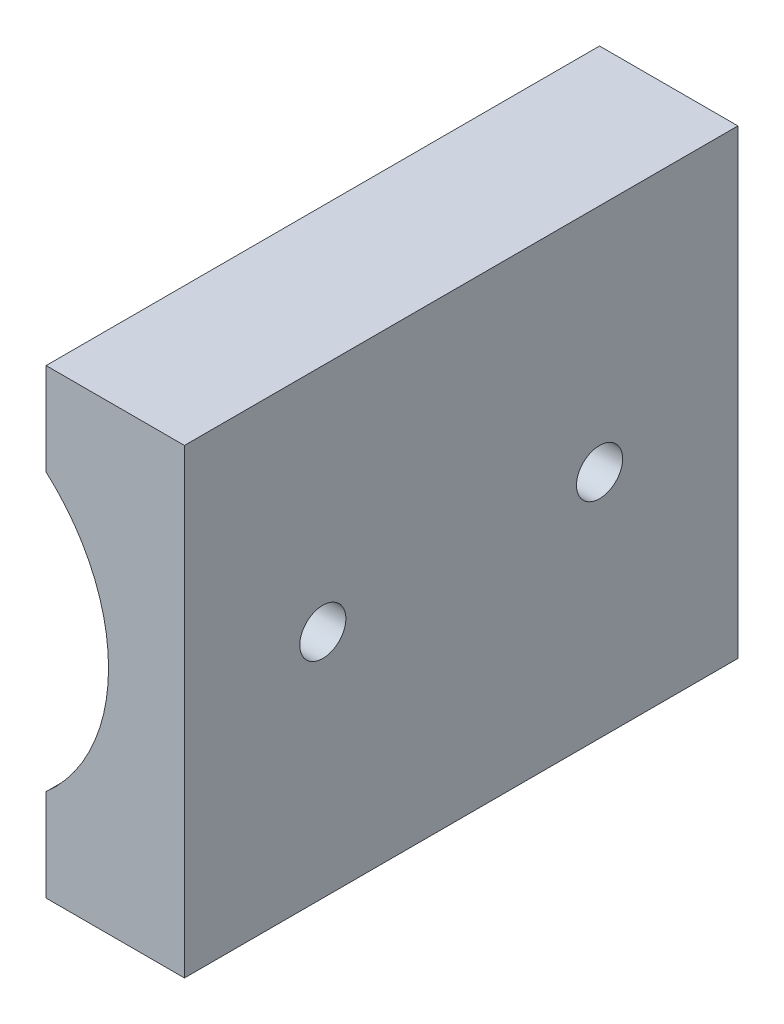
from build123d import *

# Parameters (mm, degrees)
BOSS_EXTRUDE1_DEPTH            = 60
CUT_EXTRUDE1_REACH             = 69.704
CUT_EXTRUDE1_END_RADIUS        = 20
SKETCH3_R                      = 2.5
CUT_EXTRUDE1_DIRECTION_2_DEPTH = 68.704354886


with BuildPart() as part:
    # Sketch2 → Boss-Extrude1 (new body)
    with BuildSketch(Plane.XY):
        with BuildLine():
            Line((0, 22.452229299), (0, -27.547770701))
            Line((0, -27.547770701), (-15, -27.547770701))
            Line((-15, -27.547770701), (-15, -17.547770701))
            ThreePointArc((-15, -17.547770701), (-8.228756555, -2.547770701), (-15, 12.452229299))
            Line((-15, 12.452229299), (-15, 22.452229299))
            Line((-15, 22.452229299), (0, 22.452229299))
        make_face()
    extrude(amount=BOSS_EXTRUDE1_DEPTH)

    # Cut-Extrude1: up to this cylinder (the profile starts outside it)
    cut_extrude1_end = Plane(origin=(-28.228756555, -2.547770701, 30), z_dir=(0, 0, -1)) * Cylinder(CUT_EXTRUDE1_END_RADIUS, 210.408, mode=Mode.PRIVATE)
    # Sketch3 → Cut-Extrude1 (cut, up to the surface)
    with BuildSketch(Plane(origin=(0, 0, 0), x_dir=(0, 0, -1), z_dir=(1, 0, 0)), mode=Mode.PRIVATE) as cut_extrude1_sk1:
        with Locations(Location((-15, -2.547770701, 0), (0, 0, 180))):
            Circle(SKETCH3_R)
    cut_extrude1_tool1 = extrude(cut_extrude1_sk1.sketch, amount=-CUT_EXTRUDE1_REACH, mode=Mode.PRIVATE) - cut_extrude1_end
    add(cut_extrude1_tool1.solids().sort_by_distance((0, -2.547771, 15))[0], mode=Mode.SUBTRACT)
    # Sketch3 → Cut-Extrude1 (cut, up to the surface)
    with BuildSketch(Plane(origin=(0, 0, 0), x_dir=(0, 0, -1), z_dir=(1, 0, 0)), mode=Mode.PRIVATE) as cut_extrude1_sk2:
        with Locations(Location((-45, -2.547770701, 0), (0, 0, 180))):
            Circle(SKETCH3_R)
    cut_extrude1_tool2 = extrude(cut_extrude1_sk2.sketch, amount=-CUT_EXTRUDE1_REACH, mode=Mode.PRIVATE) - cut_extrude1_end
    add(cut_extrude1_tool2.solids().sort_by_distance((0, -2.547771, 45))[0], mode=Mode.SUBTRACT)

    # Sketch3 → Cut-Extrude1 direction 2 (cut)
    with BuildSketch(Plane(origin=(0, 0, 0), x_dir=(0, 0, -1), z_dir=(1, 0, 0))):
        with Locations(Location((-15, -2.547770701, 0), (0, 0, 180))):
            Circle(SKETCH3_R)
        with Locations(Location((-45, -2.547770701, 0), (0, 0, 180))):
            Circle(SKETCH3_R)
    extrude(amount=CUT_EXTRUDE1_DIRECTION_2_DEPTH, mode=Mode.SUBTRACT)


solid = part.part
